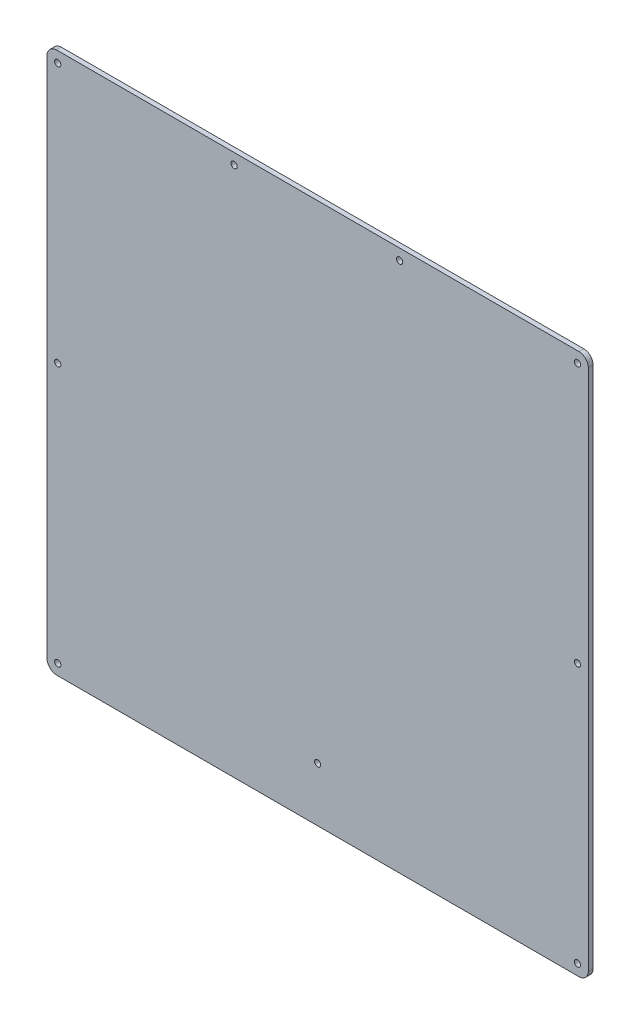
from build123d import *

# Parameters (mm, degrees)
MODEL_R             = 1
BOSS_EXTRUDE1_DEPTH = 1.55


with BuildPart() as part:
    # Model → Boss-Extrude1 (new body)
    with BuildSketch(Plane.XY):
        with BuildLine():
            Line((3, 0), (172, 0))
            ThreePointArc((172, 0), (174.121320344, 0.878679656), (175, 3))
            Line((175, 3), (175, 172))
            ThreePointArc((175, 172), (174.121320344, 174.121320344), (172, 175))
            Line((172, 175), (3, 175))
            ThreePointArc((3, 175), (0.775125888, 173.871320668), (0, 171.5))
            Line((0, 171.5), (0, 3.5))
            ThreePointArc((0, 3.5), (0.775125888, 1.128679332), (3, 0))
        make_face()
        with Locations(Location((3.5, 3.5, 0), (0, 0, 180))):
            Circle(MODEL_R, mode=Mode.SUBTRACT)
        with Locations(Location((87.5, 17.5, 0), (0, 0, 180))):
            Circle(MODEL_R, mode=Mode.SUBTRACT)
        with Locations(Location((171.5, 3.5, 0), (0, 0, 180))):
            Circle(MODEL_R, mode=Mode.SUBTRACT)
        with Locations(Location((171.5, 87.5, 0), (0, 0, 180))):
            Circle(MODEL_R, mode=Mode.SUBTRACT)
        with Locations(Location((3.5, 87.5, 0), (0, 0, 180))):
            Circle(MODEL_R, mode=Mode.SUBTRACT)
        with Locations(Location((171.5, 171.5, 0), (0, 0, 180))):
            Circle(MODEL_R, mode=Mode.SUBTRACT)
        with Locations(Location((60.5, 171.5, 0), (0, 0, 180))):
            Circle(MODEL_R, mode=Mode.SUBTRACT)
        with Locations(Location((3.5, 171.5, 0), (0, 0, 180))):
            Circle(MODEL_R, mode=Mode.SUBTRACT)
        with Locations(Location((114, 171.5, 0), (0, 0, 180))):
            Circle(MODEL_R, mode=Mode.SUBTRACT)
    extrude(amount=BOSS_EXTRUDE1_DEPTH)


solid = part.part
